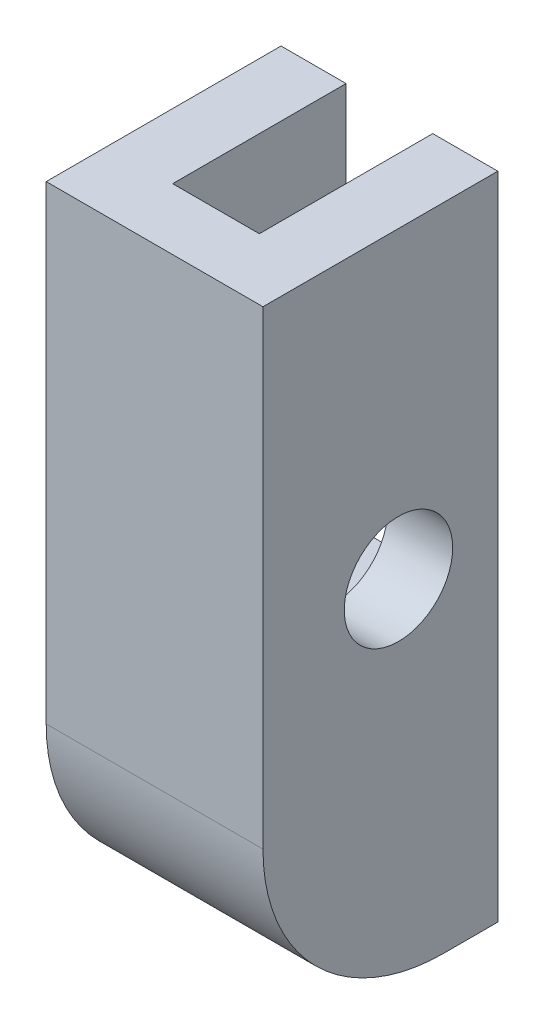
from build123d import *

# Parameters (mm, degrees)
SKETCH2_W           = 16.51
SKETCH2_H           = 45.72
BOSS_EXTRUDE1_DEPTH = 7.62
FILLET1_R           = 12.7
SKETCH3_W           = 6.096
SKETCH3_H           = 26.67
CUT_EXTRUDE1_DEPTH  = 12.192
SKETCH4_R           = 3.81
CUT_EXTRUDE2_DEPTH  = 29.687666775


with BuildPart() as part:
    # Sketch2 → Boss-Extrude1 (new, symmetric)
    with BuildSketch(Plane(origin=(0, 0, 0), x_dir=(0, 0, -1), z_dir=(1, 0, 0))):
        Rectangle(SKETCH2_W, SKETCH2_H)
    extrude(amount=BOSS_EXTRUDE1_DEPTH, both=True)

    # Fillet1
    fillet1_edges = [part.edges().sort_by_distance(p)[0] for p in [
        (0, -22.86, 8.255),
    ]]
    fillet(fillet1_edges, radius=FILLET1_R)

    # Sketch3 → Cut-Extrude1 (cut)
    with BuildSketch(Plane(origin=(0, 0, -8.255), x_dir=(-1, 0, 0), z_dir=(0, 0, -1))):
        with Locations((0, 9.525)):
            Rectangle(SKETCH3_W, SKETCH3_H)
    extrude(amount=-CUT_EXTRUDE1_DEPTH, mode=Mode.SUBTRACT)

    # Sketch4 → Cut-Extrude2 (cut, through all)
    with BuildSketch(Plane(origin=(7.62, 0, 0), x_dir=(0, 0, -1), z_dir=(1, 0, 0))):
        with Locations((1.27, 1.524)):
            Circle(SKETCH4_R)
    extrude(amount=-CUT_EXTRUDE2_DEPTH, mode=Mode.SUBTRACT)


solid = part.part
